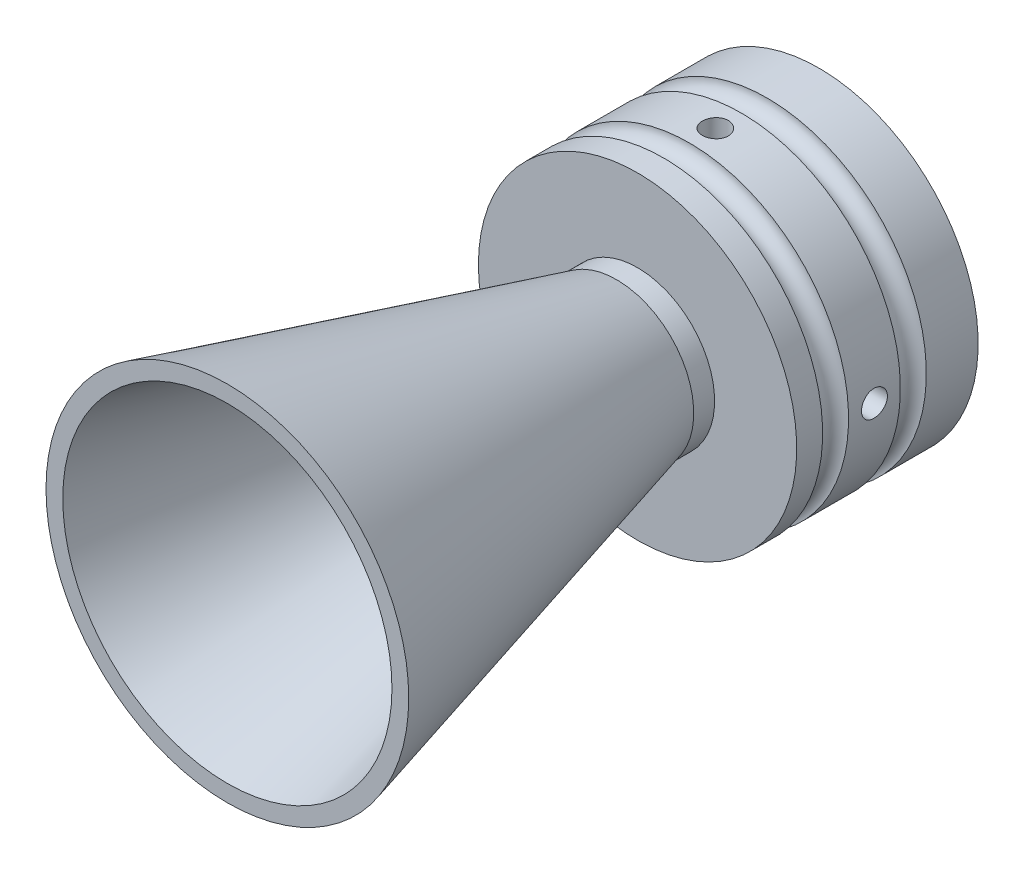
from build123d import *

# Parameters (mm, degrees)
F_4_0MM_DOWEL_HOLE1_D               = 4
F_4_0MM_DOWEL_HOLE1_DEPTH           = 5
F_4_0MM_DOWEL_HOLE1_TIP             = 1.201721238
F_4_0MM_DOWEL_HOLE1_ON_FACE_2_D     = 4
F_4_0MM_DOWEL_HOLE1_ON_FACE_2_DEPTH = 5
F_4_0MM_DOWEL_HOLE1_ON_FACE_2_TIP   = 1.201721238
F_4_0MM_DOWEL_HOLE1_ON_FACE_3_D     = 4
F_4_0MM_DOWEL_HOLE1_ON_FACE_3_DEPTH = 5
F_4_0MM_DOWEL_HOLE1_ON_FACE_3_TIP   = 1.201721238
F_4_0MM_DOWEL_HOLE1_ON_FACE_4_D     = 4
F_4_0MM_DOWEL_HOLE1_ON_FACE_4_DEPTH = 5
F_4_0MM_DOWEL_HOLE1_ON_FACE_4_TIP   = 1.201721238
F_4_0MM_DOWEL_HOLE1_ON_FACE_5_D     = 4
F_4_0MM_DOWEL_HOLE1_ON_FACE_5_DEPTH = 5
F_4_0MM_DOWEL_HOLE1_ON_FACE_5_TIP   = 1.201721238


with BuildPart() as part:
    # Sketch1 → Revolve2 (revolve)
    with BuildSketch(Plane(origin=(0, 0, 0), x_dir=(1, 0, 0), z_dir=(0, 1, 0)), mode=Mode.PRIVATE) as revolve2_sk:
        with BuildLine():
            Line((24.5618, 27.144353846), (8.89, 0))
            Line((8.89, 0), (8.89, -2.54))
            Line((8.89, -2.54), (25.4, -64.156158833))
            Line((25.4, -64.156158833), (27.988190451, -64.156158833))
            Line((27.988190451, -64.156158833), (11.89, -4.07689416))
            Line((11.89, -4.07689416), (11.89, -0.855646154))
            Line((11.89, -0.855646154), (24.5618, -0.855646154))
            Line((24.5618, -0.855646154), (24.5618, 3.144353846))
            ThreePointArc((24.5618, 3.144353846), (22.5618, 5.144353846), (24.5618, 7.144353846))
            Line((24.5618, 7.144353846), (24.5618, 15.144353846))
            ThreePointArc((24.5618, 15.144353846), (22.5618, 17.144353846), (24.5618, 19.144353846))
            Line((24.5618, 19.144353846), (24.5618, 27.144353846))
        make_face()
    revolve(revolve2_sk.sketch.rotate(Axis((0, 0, -75.308440558), (0, 0, 1)), 180), axis=Axis((0, 0, -75.308440558), (0, 0, 1)))

    # Ø4.0mm Dowel Hole1
    with Locations(Plane(origin=(-24.5618, 0, -11.144353846), x_dir=(0, -1, 0), z_dir=(-1, 0, 0))):
        with Locations((0, 0)):
            Hole(F_4_0MM_DOWEL_HOLE1_D / 2, depth=F_4_0MM_DOWEL_HOLE1_DEPTH)
            with Locations((0, 0, -(F_4_0MM_DOWEL_HOLE1_DEPTH + F_4_0MM_DOWEL_HOLE1_TIP / 2))):  # 118° drill point
                Cone(0, F_4_0MM_DOWEL_HOLE1_D / 2, F_4_0MM_DOWEL_HOLE1_TIP, mode=Mode.SUBTRACT)

    # Ø4.0mm Dowel Hole1 on face 2
    with Locations(Plane(origin=(0, 0, 0), x_dir=(0, -1, 0), z_dir=(-1, 0, 0))):
        with Locations((0, 0)):
            Hole(F_4_0MM_DOWEL_HOLE1_ON_FACE_2_D / 2, depth=F_4_0MM_DOWEL_HOLE1_ON_FACE_2_DEPTH)
            with Locations((0, 0, -(F_4_0MM_DOWEL_HOLE1_ON_FACE_2_DEPTH + F_4_0MM_DOWEL_HOLE1_ON_FACE_2_TIP / 2))):  # 118° drill point
                Cone(0, F_4_0MM_DOWEL_HOLE1_ON_FACE_2_D / 2, F_4_0MM_DOWEL_HOLE1_ON_FACE_2_TIP, mode=Mode.SUBTRACT)

    # Ø4.0mm Dowel Hole1 on face 3
    with Locations(Plane(origin=(0, 24.5618, -11.144353846), x_dir=(0, 0, 1), z_dir=(0, 1, 0))):
        with Locations((0, 0)):
            Hole(F_4_0MM_DOWEL_HOLE1_ON_FACE_3_D / 2, depth=F_4_0MM_DOWEL_HOLE1_ON_FACE_3_DEPTH)
            with Locations((0, 0, -(F_4_0MM_DOWEL_HOLE1_ON_FACE_3_DEPTH + F_4_0MM_DOWEL_HOLE1_ON_FACE_3_TIP / 2))):  # 118° drill point
                Cone(0, F_4_0MM_DOWEL_HOLE1_ON_FACE_3_D / 2, F_4_0MM_DOWEL_HOLE1_ON_FACE_3_TIP, mode=Mode.SUBTRACT)

    # Ø4.0mm Dowel Hole1 on face 4
    with Locations(Plane(origin=(24.5618, 0, -11.144353846), x_dir=(0, 0, 1), z_dir=(1, 0, 0))):
        with Locations((0, 0)):
            Hole(F_4_0MM_DOWEL_HOLE1_ON_FACE_4_D / 2, depth=F_4_0MM_DOWEL_HOLE1_ON_FACE_4_DEPTH)
            with Locations((0, 0, -(F_4_0MM_DOWEL_HOLE1_ON_FACE_4_DEPTH + F_4_0MM_DOWEL_HOLE1_ON_FACE_4_TIP / 2))):  # 118° drill point
                Cone(0, F_4_0MM_DOWEL_HOLE1_ON_FACE_4_D / 2, F_4_0MM_DOWEL_HOLE1_ON_FACE_4_TIP, mode=Mode.SUBTRACT)

    # Ø4.0mm Dowel Hole1 on face 5
    with Locations(Plane(origin=(0, -24.5618, -11.144353846), x_dir=(0, 0, -1), z_dir=(0, -1, 0))):
        with Locations((0, 0)):
            Hole(F_4_0MM_DOWEL_HOLE1_ON_FACE_5_D / 2, depth=F_4_0MM_DOWEL_HOLE1_ON_FACE_5_DEPTH)
            with Locations((0, 0, -(F_4_0MM_DOWEL_HOLE1_ON_FACE_5_DEPTH + F_4_0MM_DOWEL_HOLE1_ON_FACE_5_TIP / 2))):  # 118° drill point
                Cone(0, F_4_0MM_DOWEL_HOLE1_ON_FACE_5_D / 2, F_4_0MM_DOWEL_HOLE1_ON_FACE_5_TIP, mode=Mode.SUBTRACT)


solid = part.part
